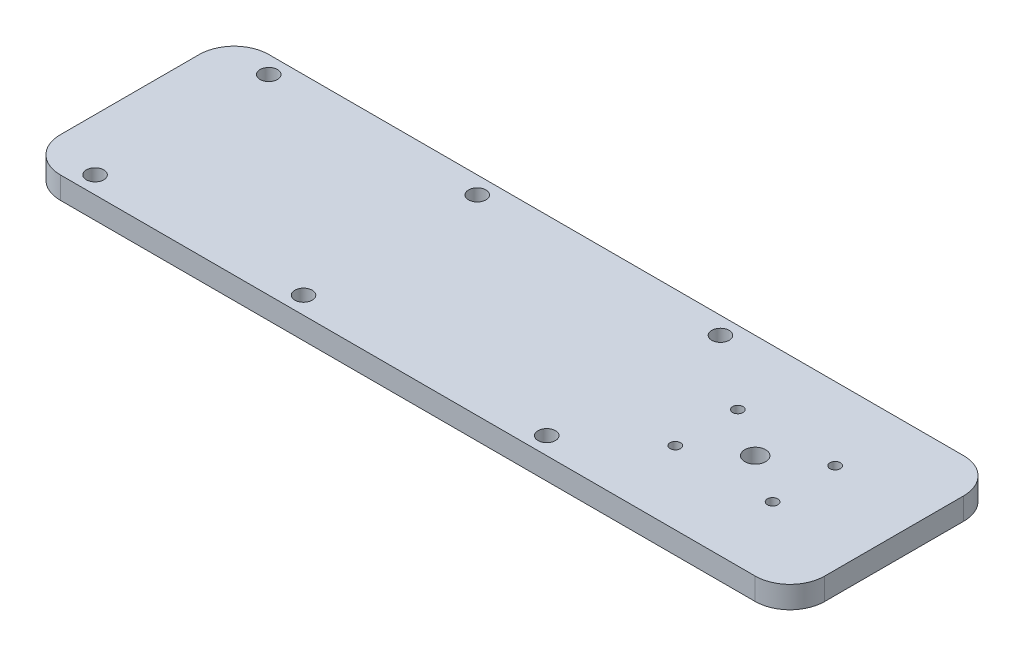
from build123d import *

# Parameters (mm, degrees)
SKETCH1_W             = 220
SKETCH1_H             = 60
BOSS_EXTRUDE1_DEPTH   = 6.35
FILLET1_R             = 10
F_6_0MM_DOWEL_HOLE1_D = 6
F_3_0MM_DOWEL_HOLE1_D = 3
F_5_0MM_DOWEL_HOLE1_D = 5


with BuildPart() as part:
    # Sketch1 → Boss-Extrude1 (new body)
    with BuildSketch(Plane(origin=(0, 0, 0), x_dir=(1, 0, 0), z_dir=(0, 1, 0))):
        with Locations((55, 0)):
            Rectangle(SKETCH1_W, SKETCH1_H)
    extrude(amount=BOSS_EXTRUDE1_DEPTH)

    # Fillet1
    fillet1_edges = [part.edges().sort_by_distance(p)[0] for p in [
        (-55, 3.175, -30),
        (165, 3.175, -30),
        (165, 3.175, 30),
        (-55, 3.175, 30),
    ]]
    fillet(fillet1_edges, radius=FILLET1_R)

    # Ø6.0mm Dowel Hole1 (through all)
    with Locations(Plane(origin=(0, 6.35, 0), x_dir=(1, 0, 0), z_dir=(0, 1, 0))):
        with Locations((125, 0)):
            Hole(F_6_0MM_DOWEL_HOLE1_D / 2)

    # Ø3.0mm Dowel Hole1 (through all)
    with Locations(Plane(origin=(0, 6.35, 0), x_dir=(1, 0, 0), z_dir=(0, 1, 0))):
        with Locations((139, -9), (111, -9), (111, 9), (139, 9)):
            Hole(F_3_0MM_DOWEL_HOLE1_D / 2)

    # Ø5.0mm Dowel Hole1 (through all)
    with Locations(Plane(origin=(0, 6.35, 0), x_dir=(1, 0, 0), z_dir=(0, 1, 0))):
        with Locations((20, -25), (90, -25), (90, 25), (20, 25), (-40, -25), (-40, 25)):
            Hole(F_5_0MM_DOWEL_HOLE1_D / 2)


solid = part.part
